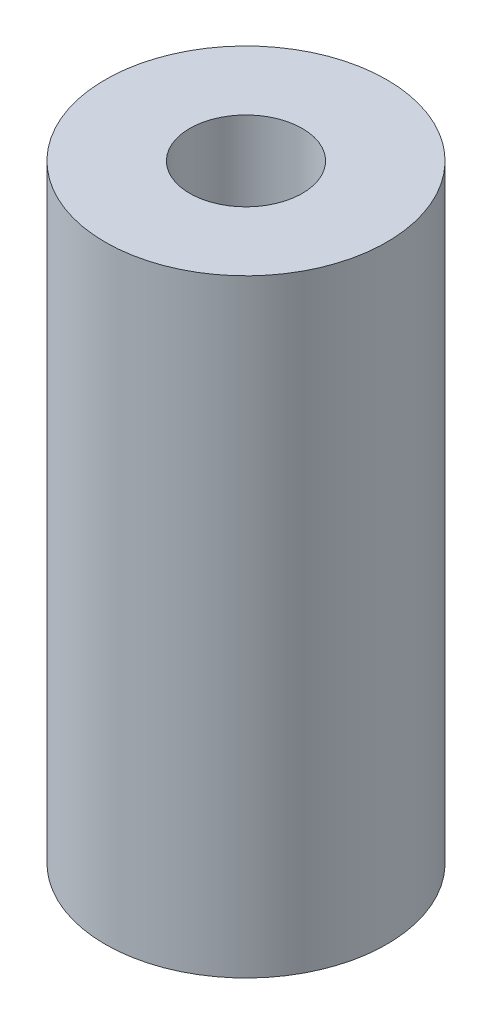
from build123d import *

# Parameters (mm, degrees)
SKETCH_1_R      = 2.5
SKETCH_1_R_2    = 1
EXTRUDE_1_DEPTH = 10.8


with BuildPart() as part:
    # 草图1 → 凸台-拉伸1 (new body)
    with BuildSketch(Plane(origin=(0, 0, 0), x_dir=(1, 0, 0), z_dir=(0, 1, 0))):
        with Locations(Location((0, 0, 0), (0, 0, 90))):
            Circle(SKETCH_1_R)
        with Locations(Location((0, 0, 0), (0, 0, 90))):
            Circle(SKETCH_1_R_2, mode=Mode.SUBTRACT)
    extrude(amount=EXTRUDE_1_DEPTH)


solid = part.part
